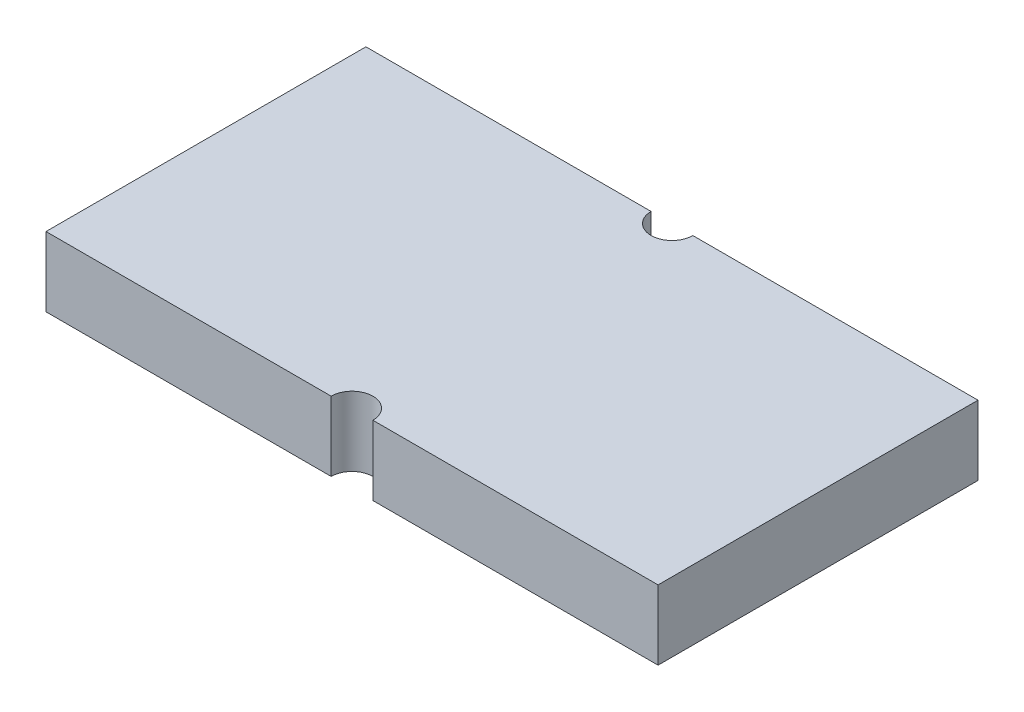
from build123d import *

# Parameters (mm, degrees)
SKETCH_1_W          = 44
SKETCH_1_H          = 23
EXTRUDE_1_DEPTH     = 5
SKETCH_2_R          = 1.5
CUT_EXTRUDE_1_DEPTH = 10


with BuildPart() as part:
    # 草图1 → 凸台-拉伸1 (new body)
    with BuildSketch(Plane(origin=(0, 0, 0), x_dir=(1, 0, 0), z_dir=(0, 1, 0))):
        Rectangle(SKETCH_1_W, SKETCH_1_H)
    extrude(amount=EXTRUDE_1_DEPTH)

    # 草图2 → 切除-拉伸1 (cut)
    with BuildSketch(Plane(origin=(0, 5, 0), x_dir=(1, 0, 0), z_dir=(0, 1, 0))):
        with Locations((0, 11.5)):
            Circle(SKETCH_2_R)
        with Locations((0, -11.5)):
            Circle(SKETCH_2_R)
    extrude(amount=-CUT_EXTRUDE_1_DEPTH, mode=Mode.SUBTRACT)


solid = part.part
